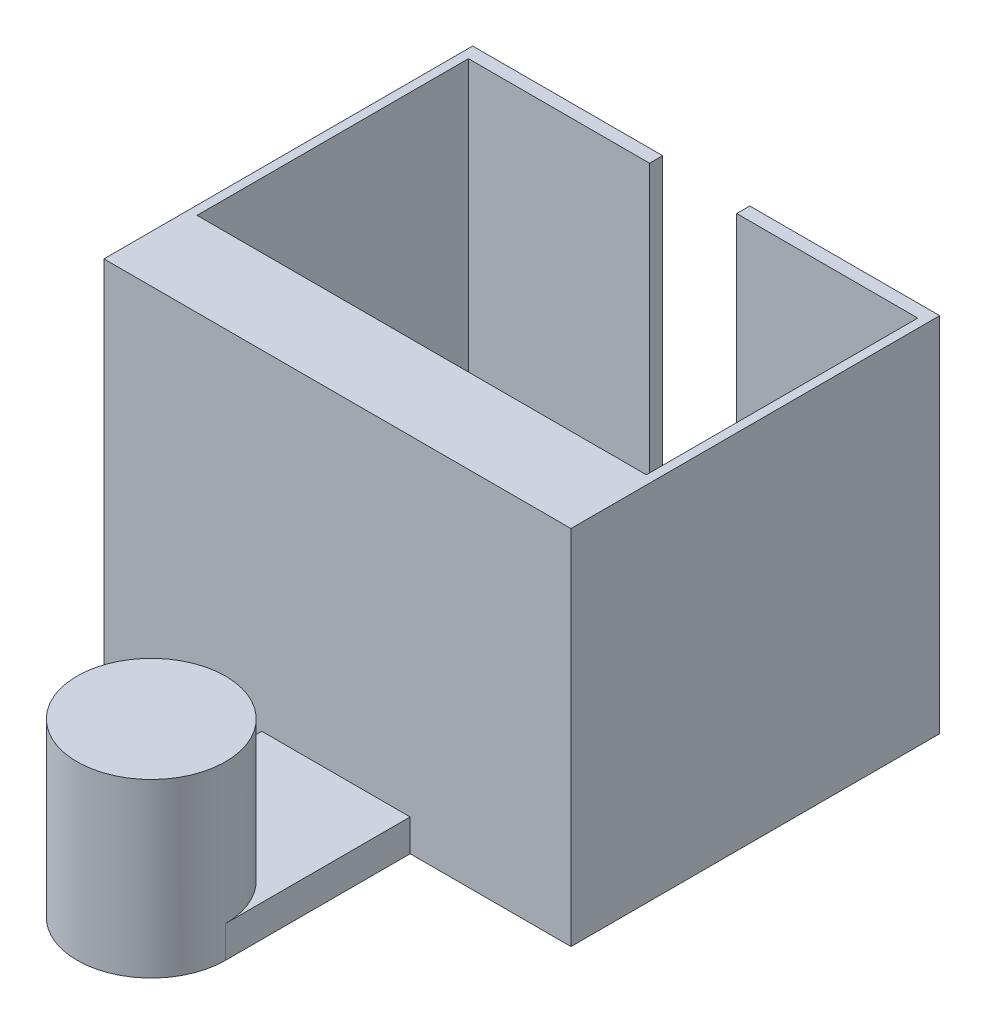
from build123d import *

# Parameters (mm, degrees)
BOSS_EXTRUDE1_DEPTH = 50.8
SKETCH3_W           = 20.832647018
SKETCH3_H           = 4.473256697
BOSS_EXTRUDE2_DEPTH = 25.908
SKETCH5_R           = 10.416323509
BOSS_EXTRUDE3_DEPTH = 24.13


with BuildPart() as part:
    # Sketch2 → Boss-Extrude1 (new body)
    with BuildSketch(Plane(origin=(0, 0, 0), x_dir=(1, 0, 0), z_dir=(0, 1, 0))):
        Polygon((66.696577012, 107.786627361), (66.696577012, 105.952916401), (41.286417012, 105.952916401), (41.286417012, 67.871966401), (104.329217012, 67.871966401), (104.329217012, 105.952916401), (78.919057012, 105.952916401), (78.919057012, 107.786627361), (105.573817012, 107.786627361), (105.573817012, 56.048909831), (40.041817012, 56.048909831), (40.041817012, 107.786627361), align=None)
    extrude(amount=BOSS_EXTRUDE1_DEPTH)

    # Sketch3 → Boss-Extrude2 (add)
    with BuildSketch(Plane.XY.offset(-56.048909831)):
        with Locations((72.594457012, 2.236628349)):
            Rectangle(SKETCH3_W, SKETCH3_H)
    extrude(amount=BOSS_EXTRUDE2_DEPTH)

    # Sketch5 → Boss-Extrude3 (add)
    with BuildSketch(Plane.XZ):
        with Locations(Location((72.594457012, -30.140909831, 0), (0, 0, 270))):
            Circle(SKETCH5_R)
    extrude(amount=-BOSS_EXTRUDE3_DEPTH)


solid = part.part
